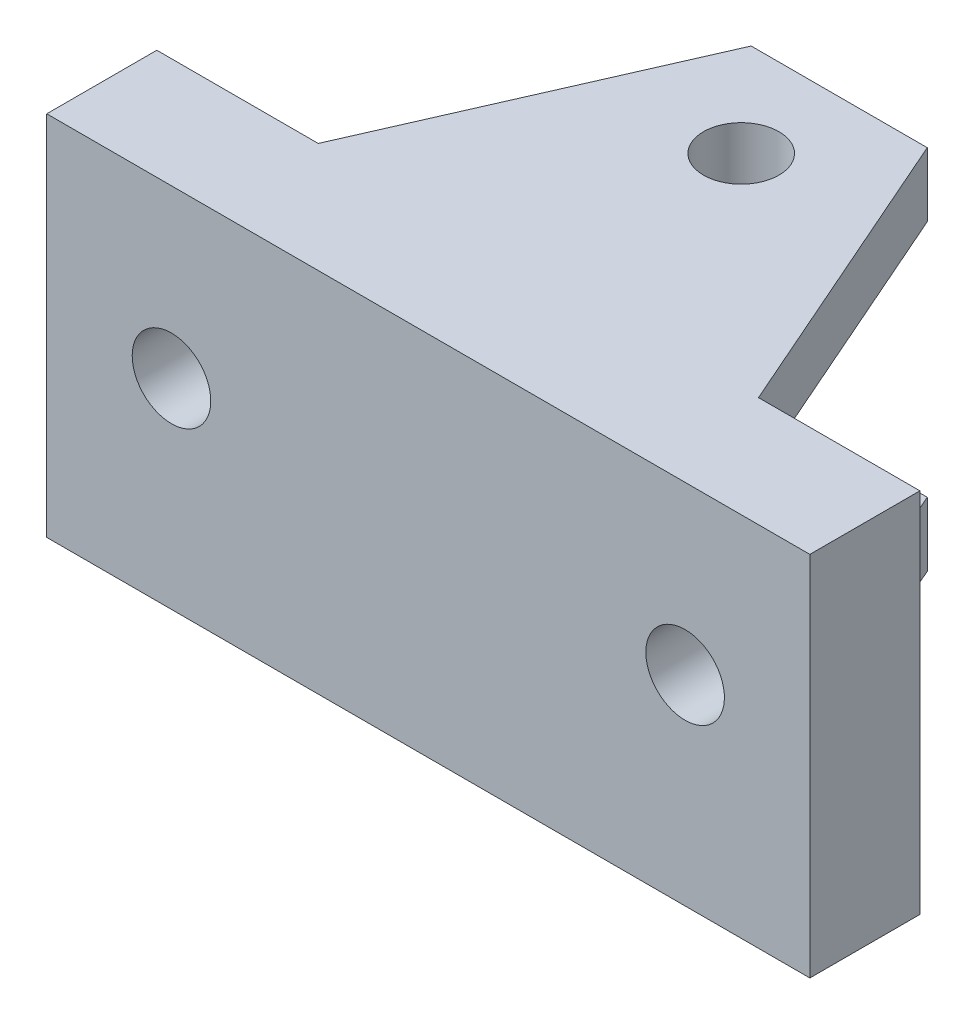
from build123d import *

# Parameters (mm, degrees)
BOSS_EXTRUDE1_DEPTH = 76.2
SKETCH2_R           = 3.4
CUT_EXTRUDE1_DEPTH  = 9.525
CUT_EXTRUDE2_REACH  = 93.635
SKETCH3_R           = 3.2639
SKETCH4_W           = 5.08
SKETCH4_H           = 31.75
CUT_EXTRUDE3_DEPTH  = 9.525


with BuildPart() as part:
    # Sketch1 → Boss-Extrude1 (new body)
    with BuildSketch(Plane(origin=(0, 0, 0), x_dir=(0, 0, -1), z_dir=(1, 0, 0))):
        Polygon((0, 8.712610854), (0, 40.462610854), (39.779713659, 40.462610854), (39.779713659, 34.912710854), (9.525, 34.912710854), (9.525, 14.262510854), (39.779713659, 14.262510854), (39.779713659, 8.712610854), align=None)
    extrude(amount=BOSS_EXTRUDE1_DEPTH)

    # Sketch2 → Cut-Extrude1 (cut)
    with BuildSketch(Plane(origin=(0, 0, -9.525), x_dir=(-1, 0, 0), z_dir=(0, 0, -1))):
        with Locations((-60.325, 26.02985118)):
            Circle(SKETCH2_R)
        with Locations((-15.875, 26.02985118)):
            Circle(SKETCH2_R)
    extrude(amount=-CUT_EXTRUDE1_DEPTH, mode=Mode.SUBTRACT)

    # Cut-Extrude2: up to this face of the body (flat: up to its plane)
    cut_extrude2_end = Plane(part.part.faces().sort_by_distance((38.1, 8.712610854, -19.889856829))[0])
    # Sketch3 → Cut-Extrude2 (cut, up to the picked face)
    with BuildSketch(Plane(origin=(0, 40.462610854, 0), x_dir=(1, 0, 0), z_dir=(0, 1, 0)), mode=Mode.PRIVATE) as cut_extrude2_sk1:
        with Locations(Location((38.1, 27.079713659, 0), (0, 0, 270))):
            Circle(SKETCH3_R)
    cut_extrude2_tool1 = split(extrude(cut_extrude2_sk1.sketch, amount=-CUT_EXTRUDE2_REACH, mode=Mode.PRIVATE), bisect_by=cut_extrude2_end, keep=Keep.BOTH, mode=Mode.PRIVATE)
    # Sketch3 → Cut-Extrude2 (cut, up to the picked face)
    with BuildSketch(Plane(origin=(0, 40.462610854, 0), x_dir=(1, 0, 0), z_dir=(0, 1, 0)), mode=Mode.PRIVATE) as cut_extrude2_sk2:
        Polygon((30.48, 35.56), (19.05, 9.525), (0, 9.525), (0, 39.779713659), (76.2, 39.779713659), (76.2, 9.525), (57.15, 9.525), (45.72, 35.56), align=None)
    cut_extrude2_tool2 = split(extrude(cut_extrude2_sk2.sketch, amount=-CUT_EXTRUDE2_REACH, mode=Mode.PRIVATE), bisect_by=cut_extrude2_end, keep=Keep.BOTH, mode=Mode.PRIVATE)
    add(cut_extrude2_tool1.solids().sort_by(Axis((38.1, 40.462611, -27.079714), (0, -1, 0)))[0], mode=Mode.SUBTRACT)
    add(cut_extrude2_tool2.solids().sort_by(Axis((24.014295, 40.462611, -22.872078), (0, -1, 0)))[0], mode=Mode.SUBTRACT)

    # Sketch4 → Cut-Extrude3 (cut)
    with BuildSketch(Plane(origin=(0, 0, -9.525), x_dir=(-1, 0, 0), z_dir=(0, 0, -1))):
        with Locations((-2.54, 24.587610854)):
            Rectangle(SKETCH4_W, SKETCH4_H)
        with Locations((-73.66, 24.587610854)):
            Rectangle(SKETCH4_W, SKETCH4_H)
    extrude(amount=-CUT_EXTRUDE3_DEPTH, mode=Mode.SUBTRACT)


solid = part.part
